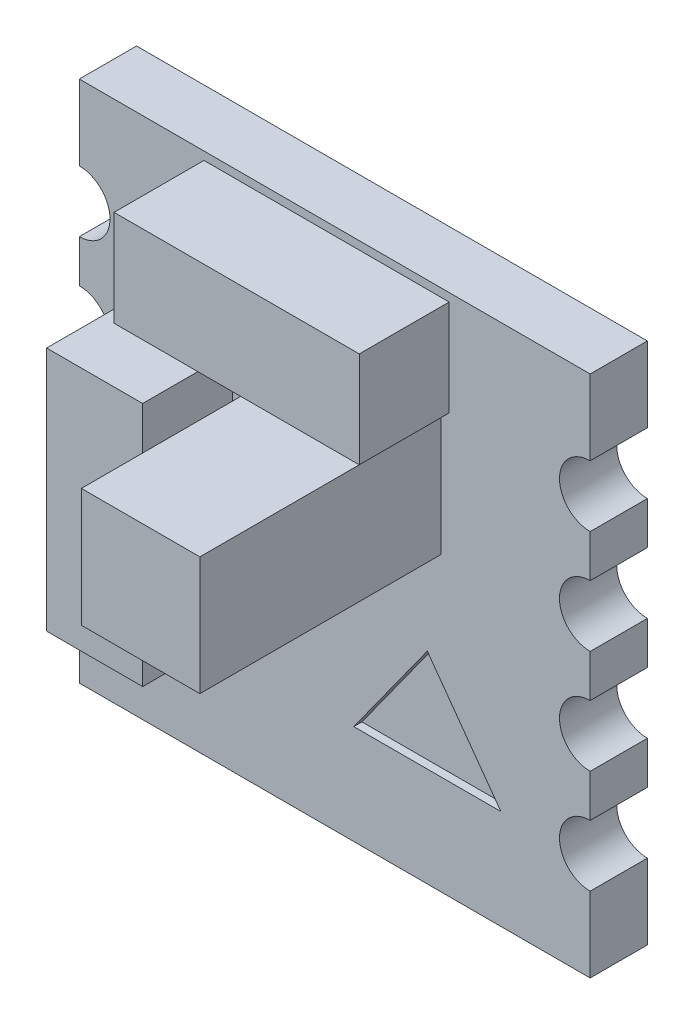
from build123d import *

# Parameters (mm, degrees)
SKETCH1_W               = 12.5
SKETCH1_H               = 12.8
BOSS_EXTRUDE1_DEPTH     = 0.7
CUT_EXTRUDE1_DEPTH      = 9.972875793
CUT_EXTRUDE1_DEPTH_BACK = 9.972875793
SKETCH2_R               = 0.75
SKETCH3_W               = 6
SKETCH3_H               = 2.35
SKETCH3_W_2             = 2.35
SKETCH3_H_2             = 6
BOSS_EXTRUDE2_DEPTH     = 2.2
SKETCH4_W               = 2.9
SKETCH4_H               = 2.9
BOSS_EXTRUDE3_DEPTH     = 5.9
CUT_EXTRUDE2_DEPTH      = 0.2


with BuildPart() as part:
    # Sketch1 → Boss-Extrude1 (new, symmetric)
    with BuildSketch(Plane.XY):
        Rectangle(SKETCH1_W, SKETCH1_H)
    extrude(amount=BOSS_EXTRUDE1_DEPTH, both=True)

    # Sketch2 → Cut-Extrude1 (cut, two sides: drawn at the far end of the back side and taken through both)
    with BuildSketch(Plane.XY.offset(-CUT_EXTRUDE1_DEPTH_BACK)):
        with Locations((-6.25, 1.27)):
            Circle(SKETCH2_R)
        with Locations((-6.25, 3.81)):
            Circle(SKETCH2_R)
        with Locations((-6.25, -1.27)):
            Circle(SKETCH2_R)
        with Locations((-6.25, -3.81)):
            Circle(SKETCH2_R)
        with Locations((6.25, -3.81)):
            Circle(SKETCH2_R)
        with Locations((6.25, -1.27)):
            Circle(SKETCH2_R)
        with Locations((6.25, 3.81)):
            Circle(SKETCH2_R)
        with Locations((6.25, 1.27)):
            Circle(SKETCH2_R)
    extrude(amount=CUT_EXTRUDE1_DEPTH + CUT_EXTRUDE1_DEPTH_BACK, mode=Mode.SUBTRACT)

    # Sketch3 → Boss-Extrude2 (add)
    with BuildSketch(Plane.XY.offset(0.7)):
        with Locations((-0.2, 5.025)):
            Rectangle(SKETCH3_W, SKETCH3_H)
        with Locations((-3.675, -0.5)):
            Rectangle(SKETCH3_W_2, SKETCH3_H_2)
    extrude(amount=BOSS_EXTRUDE2_DEPTH)

    # Sketch4 → Boss-Extrude3 (add)
    with BuildSketch(Plane.XY.offset(0.7)):
        with Locations((1.15, 2.2)):
            Rectangle(SKETCH4_W, SKETCH4_H)
    extrude(amount=BOSS_EXTRUDE3_DEPTH)

    # Sketch6 → Cut-Extrude2 (cut)
    with BuildSketch(Plane.XY.offset(0.7)):
        Polygon((2.26536139, -3.964970683), (2.26536139, -1.464970683), (0.46536139, -3.964970683), align=None)
        Polygon((4.06536139, -3.964970683), (2.26536139, -1.464970683), (2.26536139, -3.964970683), align=None)
    extrude(amount=-CUT_EXTRUDE2_DEPTH, mode=Mode.SUBTRACT)


solid = part.part
